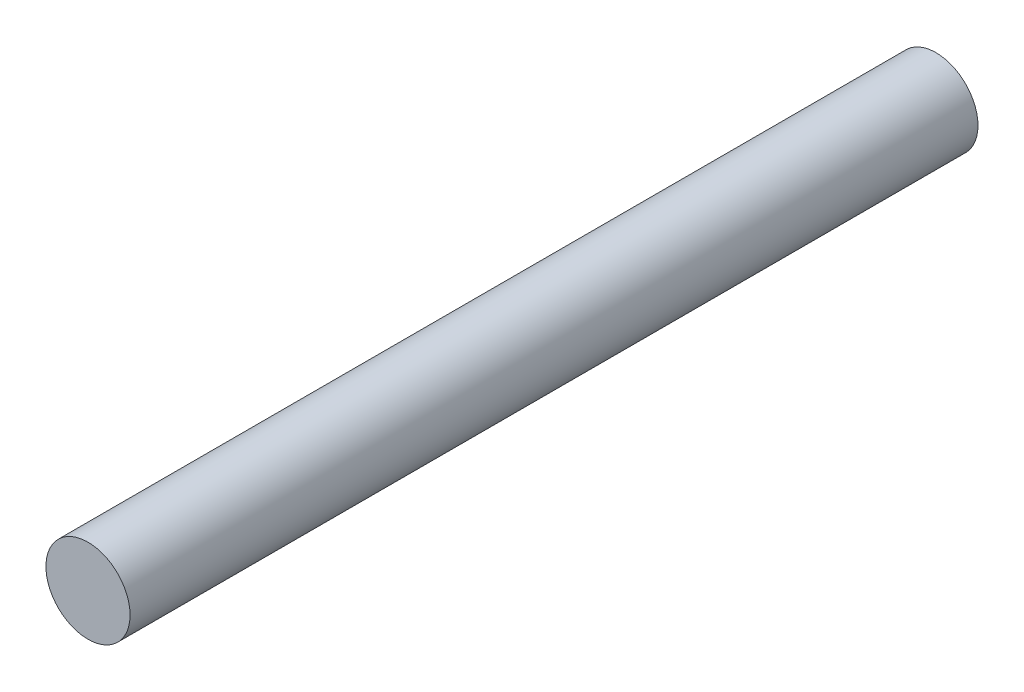
from build123d import *

# Parameters (mm, degrees)
SKETCH1_R           = 3.96875
BOSS_EXTRUDE1_DEPTH = 80


with BuildPart() as part:
    # Sketch1 → Boss-Extrude1 (new body)
    with BuildSketch(Plane.XY):
        with Locations((20, 20)):
            Circle(SKETCH1_R)
    extrude(amount=BOSS_EXTRUDE1_DEPTH)


solid = part.part
